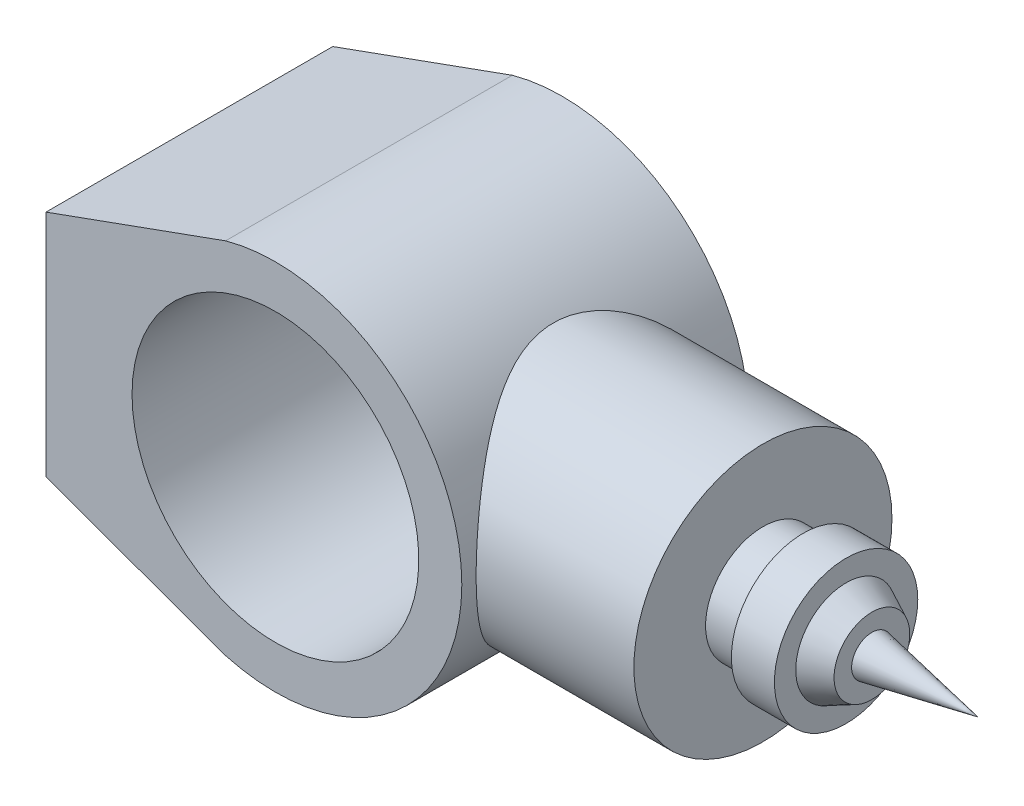
from build123d import *

# Parameters (mm, degrees)
SKETCH1_R                = 50
BOSS_EXTRUDE1_DEPTH      = 50
BOSS_EXTRUDE2_REACH      = 218.16
BOSS_EXTRUDE2_END_RADIUS = 65
SKETCH2_R                = 45


with BuildPart() as part:
    # Sketch1 → Boss-Extrude1 (new, symmetric)
    with BuildSketch(Plane.XY):
        with BuildLine():
            Line((-80, -40), (-80, 40))
            Line((-80, 40), (-17.368072784, 62.636650994))
            ThreePointArc((-17.368072784, 62.636650994), (65, 0), (-17.368072784, -62.636650994))
            Line((-17.368072784, -62.636650994), (-80, -40))
        make_face()
        with Locations(Location((0, 0, 0), (0, 0, 180))):
            Circle(SKETCH1_R, mode=Mode.SUBTRACT)
    extrude(amount=BOSS_EXTRUDE1_DEPTH, both=True)

    # Boss-Extrude2: up to this cylinder (the profile starts outside it)
    boss_extrude2_end = Plane(origin=(0, 0, 0), z_dir=(0, 0, -1)) * Cylinder(BOSS_EXTRUDE2_END_RADIUS, 567.32, mode=Mode.PRIVATE)
    # Sketch2 → Boss-Extrude2 (add, up to the surface)
    with BuildSketch(Plane(origin=(120, 0, 0), x_dir=(0, 0, -1), z_dir=(1, 0, 0)), mode=Mode.PRIVATE) as boss_extrude2_sk1:
        Circle(SKETCH2_R)
    boss_extrude2_tool1 = extrude(boss_extrude2_sk1.sketch, amount=-BOSS_EXTRUDE2_REACH, mode=Mode.PRIVATE) - boss_extrude2_end
    add(boss_extrude2_tool1.solids().sort_by_distance((120, 0, 0))[0])

    # Sketch3 → Revolve1 (revolve)
    with BuildSketch(Plane.XY, mode=Mode.PRIVATE) as revolve1_sk:
        Polygon((120, 0), (120, -20), (134, -20), (134, -25), (149, -25), (149, -17.556833969), (158, -13.197935025), (158, -7.068196984), (195, 0), align=None)
    revolve(revolve1_sk.sketch.rotate(Axis((353.949576891, 0, 0), (-1, 0, 0)), 270), axis=Axis((353.949576891, 0, 0), (-1, 0, 0)))


solid = part.part
